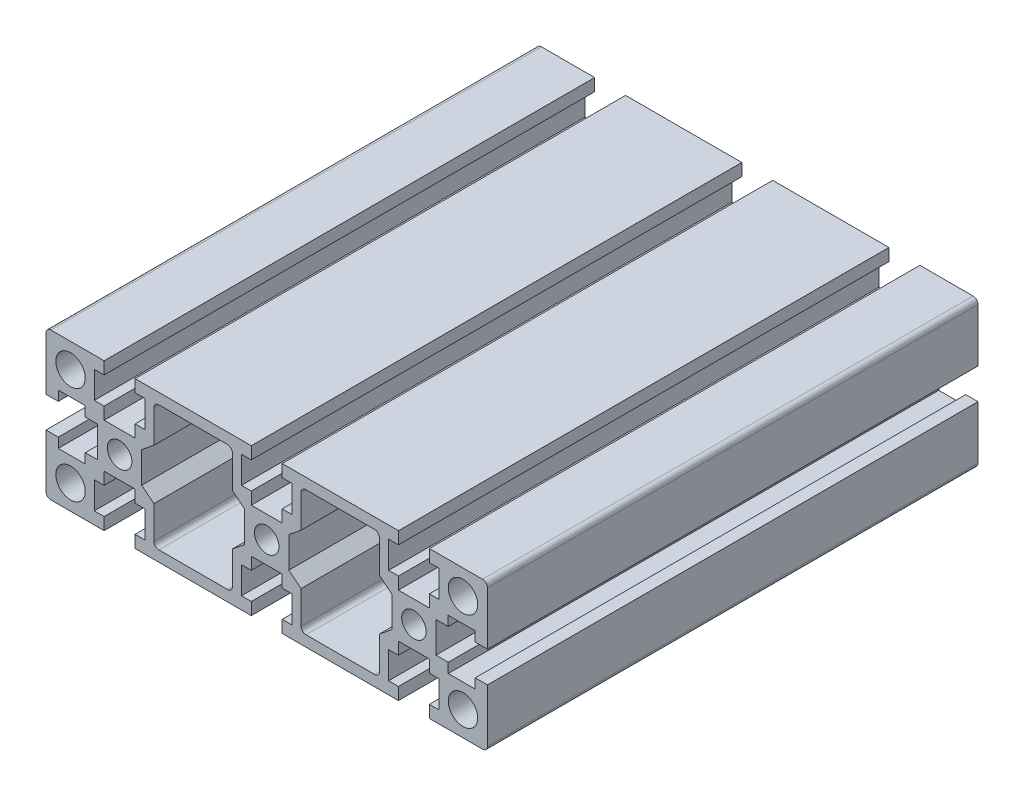
from build123d import *

# Parameters (mm, degrees)
EXTRUDE_1_DEPTH = 100


with BuildPart() as part:
    # 草图1 → 凸台-拉伸1 (new body)
    with BuildSketch(Plane.XY):
        with BuildLine():
            Line((-25.818782805, -14.848597483), (-14.968782805, -14.848597483))
            Line((-14.968782805, -14.848597483), (-2.118782805, -14.848597483))
            Line((-2.118782805, -14.848597483), (-2.118782805, -12.348597483))
            Line((-2.118782805, -12.348597483), (-4.118782805, -12.348597483))
            Line((-4.118782805, -12.348597483), (-4.118782805, -6.848597483))
            Line((-4.118782805, -6.848597483), (-2.118782805, -6.848597483))
            Line((-2.118782805, -6.848597483), (-2.118782805, -4.348597483))
            Line((-2.118782805, -4.348597483), (1.031217195, -4.348597483))
            Line((1.031217195, -4.348597483), (4.181217195, -4.348597483))
            Line((4.181217195, -4.348597483), (4.181217195, -6.848597483))
            Line((4.181217195, -6.848597483), (6.181217195, -6.848597483))
            Line((6.181217195, -6.848597483), (6.181217195, -12.348597483))
            Line((6.181217195, -12.348597483), (4.181217195, -12.348597483))
            Line((4.181217195, -12.348597483), (4.181217195, -14.848597483))
            Line((4.181217195, -14.848597483), (17.031217195, -14.848597483))
            Line((17.031217195, -14.848597483), (27.881217195, -14.848597483))
            Line((27.881217195, -14.848597483), (27.881217195, -12.348597483))
            Line((27.881217195, -12.348597483), (25.881217195, -12.348597483))
            Line((25.881217195, -12.348597483), (25.881217195, -6.848597483))
            Line((25.881217195, -6.848597483), (27.881217195, -6.848597483))
            Line((27.881217195, -6.848597483), (27.881217195, -4.348597483))
            Line((27.881217195, -4.348597483), (31.031217195, -4.348597483))
            Line((31.031217195, -4.348597483), (34.181217195, -4.348597483))
            Line((34.181217195, -4.348597483), (34.181217195, -6.848597483))
            Line((34.181217195, -6.848597483), (36.181217195, -6.848597483))
            Line((36.181217195, -6.848597483), (36.181217195, -12.348597483))
            Line((36.181217195, -12.348597483), (34.181217195, -12.348597483))
            Line((34.181217195, -12.348597483), (34.181217195, -14.848597483))
            Line((34.181217195, -14.848597483), (45.031217195, -14.848597483))
            ThreePointArc((45.031217195, -14.848597483), (45.738323976, -14.555704264), (46.031217195, -13.848597483))
            Line((46.031217195, -13.848597483), (46.031217195, -2.998597483))
            Line((46.031217195, -2.998597483), (43.531217195, -2.998597483))
            Line((43.531217195, -2.998597483), (43.531217195, -4.998597483))
            Line((43.531217195, -4.998597483), (38.031217195, -4.998597483))
            Line((38.031217195, -4.998597483), (38.031217195, -2.998597483))
            Line((38.031217195, -2.998597483), (35.531217195, -2.998597483))
            Line((35.531217195, -2.998597483), (35.531217195, 0.151402517))
            Line((35.531217195, 0.151402517), (35.531217195, 3.301402517))
            Line((35.531217195, 3.301402517), (38.031217195, 3.301402517))
            Line((38.031217195, 3.301402517), (38.031217195, 5.301402517))
            Line((38.031217195, 5.301402517), (43.531217195, 5.301402517))
            Line((43.531217195, 5.301402517), (43.531217195, 3.301402517))
            Line((43.531217195, 3.301402517), (46.031217195, 3.301402517))
            Line((46.031217195, 3.301402517), (46.031217195, 14.151402517))
            ThreePointArc((46.031217195, 14.151402517), (45.738323976, 14.858509298), (45.031217195, 15.151402517))
            Line((45.031217195, 15.151402517), (34.181217195, 15.151402517))
            Line((34.181217195, 15.151402517), (34.181217195, 12.651402517))
            Line((34.181217195, 12.651402517), (36.181217195, 12.651402517))
            Line((36.181217195, 12.651402517), (36.181217195, 7.151402517))
            Line((36.181217195, 7.151402517), (34.181217195, 7.151402517))
            Line((34.181217195, 7.151402517), (34.181217195, 4.651402517))
            Line((34.181217195, 4.651402517), (31.031217195, 4.651402517))
            Line((31.031217195, 4.651402517), (27.881217195, 4.651402517))
            Line((27.881217195, 4.651402517), (27.881217195, 7.151402517))
            Line((27.881217195, 7.151402517), (25.881217195, 7.151402517))
            Line((25.881217195, 7.151402517), (25.881217195, 12.651402517))
            Line((25.881217195, 12.651402517), (27.881217195, 12.651402517))
            Line((27.881217195, 12.651402517), (27.881217195, 15.151402517))
            Line((27.881217195, 15.151402517), (4.181217195, 15.151402517))
            Line((4.181217195, 15.151402517), (4.181217195, 12.651402517))
            Line((4.181217195, 12.651402517), (6.181217195, 12.651402517))
            Line((6.181217195, 12.651402517), (6.181217195, 7.151402517))
            Line((6.181217195, 7.151402517), (4.181217195, 7.151402517))
            Line((4.181217195, 7.151402517), (4.181217195, 4.651402517))
            Line((4.181217195, 4.651402517), (1.031217195, 4.651402517))
            Line((1.031217195, 4.651402517), (-2.118782805, 4.651402517))
            Line((-2.118782805, 4.651402517), (-2.118782805, 7.151402517))
            Line((-2.118782805, 7.151402517), (-4.118782805, 7.151402517))
            Line((-4.118782805, 7.151402517), (-4.118782805, 12.651402517))
            Line((-4.118782805, 12.651402517), (-2.118782805, 12.651402517))
            Line((-2.118782805, 12.651402517), (-2.118782805, 15.151402517))
            Line((-2.118782805, 15.151402517), (-25.818782805, 15.151402517))
            Line((-25.818782805, 15.151402517), (-25.818782805, 12.651402517))
            Line((-25.818782805, 12.651402517), (-23.818782805, 12.651402517))
            Line((-23.818782805, 12.651402517), (-23.818782805, 7.151402517))
            Line((-23.818782805, 7.151402517), (-25.818782805, 7.151402517))
            Line((-25.818782805, 7.151402517), (-25.818782805, 4.651402517))
            Line((-25.818782805, 4.651402517), (-28.968782805, 4.651402517))
            Line((-28.968782805, 4.651402517), (-32.118782805, 4.651402517))
            Line((-32.118782805, 4.651402517), (-32.118782805, 7.151402517))
            Line((-32.118782805, 7.151402517), (-34.118782805, 7.151402517))
            Line((-34.118782805, 7.151402517), (-34.118782805, 12.651402517))
            Line((-34.118782805, 12.651402517), (-32.118782805, 12.651402517))
            Line((-32.118782805, 12.651402517), (-32.118782805, 15.151402517))
            Line((-32.118782805, 15.151402517), (-42.968782805, 15.151402517))
            ThreePointArc((-42.968782805, 15.151402517), (-43.675889586, 14.858509298), (-43.968782805, 14.151402517))
            Line((-43.968782805, 14.151402517), (-43.968782805, 3.301402517))
            Line((-43.968782805, 3.301402517), (-41.468782805, 3.301402517))
            Line((-41.468782805, 3.301402517), (-41.468782805, 5.301402517))
            Line((-41.468782805, 5.301402517), (-35.968782805, 5.301402517))
            Line((-35.968782805, 5.301402517), (-35.968782805, 3.301402517))
            Line((-35.968782805, 3.301402517), (-33.468782805, 3.301402517))
            Line((-33.468782805, 3.301402517), (-33.468782805, 0.151402517))
            Line((-33.468782805, 0.151402517), (-33.468782805, -2.998597483))
            Line((-33.468782805, -2.998597483), (-35.968782805, -2.998597483))
            Line((-35.968782805, -2.998597483), (-35.968782805, -4.998597483))
            Line((-35.968782805, -4.998597483), (-41.468782805, -4.998597483))
            Line((-41.468782805, -4.998597483), (-41.468782805, -2.998597483))
            Line((-41.468782805, -2.998597483), (-43.968782805, -2.998597483))
            Line((-43.968782805, -2.998597483), (-43.968782805, -13.848597483))
            ThreePointArc((-43.968782805, -13.848597483), (-43.675889586, -14.555704264), (-42.968782805, -14.848597483))
            Line((-42.968782805, -14.848597483), (-32.118782805, -14.848597483))
            Line((-32.118782805, -14.848597483), (-32.118782805, -12.348597483))
            Line((-32.118782805, -12.348597483), (-34.118782805, -12.348597483))
            Line((-34.118782805, -12.348597483), (-34.118782805, -6.848597483))
            Line((-34.118782805, -6.848597483), (-32.118782805, -6.848597483))
            Line((-32.118782805, -6.848597483), (-32.118782805, -4.348597483))
            Line((-32.118782805, -4.348597483), (-28.968782805, -4.348597483))
            Line((-28.968782805, -4.348597483), (-25.818782805, -4.348597483))
            Line((-25.818782805, -4.348597483), (-25.818782805, -6.848597483))
            Line((-25.818782805, -6.848597483), (-23.818782805, -6.848597483))
            Line((-23.818782805, -6.848597483), (-23.818782805, -12.348597483))
            Line((-23.818782805, -12.348597483), (-25.818782805, -12.348597483))
            Line((-25.818782805, -12.348597483), (-25.818782805, -14.848597483))
        make_face()
        with BuildLine():
            Line((-24.468782805, 0.151402517), (-24.468782805, 3.301402517))
            Line((-24.468782805, 3.301402517), (-21.968782805, 5.301402517))
            Line((-21.968782805, 5.301402517), (-21.968782805, 11.951402523))
            ThreePointArc((-21.968782805, 11.951402523), (-21.675889587, 12.658509303), (-20.968782806, 12.951402523))
            Line((-20.968782806, 12.951402523), (-13.968782805, 12.951402523))
            Line((-13.968782805, 12.951402523), (-6.968782804, 12.951402523))
            ThreePointArc((-6.968782804, 12.951402523), (-6.261676023, 12.658509303), (-5.968782805, 11.951402523))
            Line((-5.968782805, 11.951402523), (-5.968782805, 5.301402517))
            Line((-5.968782805, 5.301402517), (-3.468782805, 3.301402517))
            Line((-3.468782805, 3.301402517), (-3.468782805, 0.151402517))
            Line((-3.468782805, 0.151402517), (-3.468782805, -2.998597483))
            Line((-3.468782805, -2.998597483), (-5.968782805, -4.998597483))
            Line((-5.968782805, -4.998597483), (-5.968782805, -11.648597489))
            ThreePointArc((-5.968782805, -11.648597489), (-6.261676023, -12.355704269), (-6.968782804, -12.648597489))
            Line((-6.968782804, -12.648597489), (-13.968782805, -12.648597489))
            Line((-13.968782805, -12.648597489), (-20.968782806, -12.648597489))
            ThreePointArc((-20.968782806, -12.648597489), (-21.675889587, -12.355704269), (-21.968782805, -11.648597489))
            Line((-21.968782805, -11.648597489), (-21.968782805, -4.998597483))
            Line((-21.968782805, -4.998597483), (-24.468782805, -2.998597483))
            Line((-24.468782805, -2.998597483), (-24.468782805, 0.151402517))
        make_face(mode=Mode.SUBTRACT)
        with BuildLine():
            Line((5.531217195, -2.998597468), (5.531217195, 0.151402532))
            Line((5.531217195, 0.151402532), (5.531217195, 3.301402532))
            Line((5.531217195, 3.301402532), (8.031217195, 5.301402517))
            Line((8.031217195, 5.301402517), (8.031217195, 11.951402523))
            ThreePointArc((8.031217195, 11.951402523), (8.324110413, 12.658509303), (9.031217194, 12.951402523))
            Line((9.031217194, 12.951402523), (16.031217195, 12.951402523))
            Line((16.031217195, 12.951402523), (23.031217196, 12.951402523))
            ThreePointArc((23.031217196, 12.951402523), (23.738323977, 12.658509303), (24.031217195, 11.951402523))
            Line((24.031217195, 11.951402523), (24.031217195, 5.301402517))
            Line((24.031217195, 5.301402517), (26.531217195, 3.301402517))
            Line((26.531217195, 3.301402517), (26.531217195, 0.151402517))
            Line((26.531217195, 0.151402517), (26.531217195, -2.998597483))
            Line((26.531217195, -2.998597483), (24.031217195, -4.998597483))
            Line((24.031217195, -4.998597483), (24.031217195, -11.648597489))
            ThreePointArc((24.031217195, -11.648597489), (23.738323977, -12.355704269), (23.031217196, -12.648597489))
            Line((23.031217196, -12.648597489), (16.031217195, -12.648597489))
            Line((16.031217195, -12.648597489), (9.031217194, -12.648597489))
            ThreePointArc((9.031217194, -12.648597489), (8.324110413, -12.355704269), (8.031217195, -11.648597489))
            Line((8.031217195, -11.648597489), (8.031217195, -4.998597483))
            Line((8.031217195, -4.998597483), (5.531217195, -2.998597468))
        make_face(mode=Mode.SUBTRACT)
        with BuildLine():
            ThreePointArc((-35.968782805, 10.151402517), (-38.968782805, 13.151402517), (-41.968782805, 10.151402517))
            ThreePointArc((-41.968782805, 10.151402517), (-38.968782805, 7.151402517), (-35.968782805, 10.151402517))
        make_face(mode=Mode.SUBTRACT)
        with BuildLine():
            ThreePointArc((-41.968782805, -9.848597483), (-38.968782805, -12.848597483), (-35.968782805, -9.848597483))
            ThreePointArc((-35.968782805, -9.848597483), (-38.968782805, -6.848597483), (-41.968782805, -9.848597483))
        make_face(mode=Mode.SUBTRACT)
        with BuildLine():
            ThreePointArc((-26.468782805, 0.151402517), (-28.968782805, 2.651402517), (-31.468782805, 0.151402517))
            ThreePointArc((-31.468782805, 0.151402517), (-28.968782805, -2.348597483), (-26.468782805, 0.151402517))
        make_face(mode=Mode.SUBTRACT)
        with BuildLine():
            ThreePointArc((3.531217195, 0.151402532), (1.031217195, 2.651402532), (-1.468782805, 0.151402532))
            ThreePointArc((-1.468782805, 0.151402532), (1.031217195, -2.348597468), (3.531217195, 0.151402532))
        make_face(mode=Mode.SUBTRACT)
        with BuildLine():
            ThreePointArc((44.031217195, 10.151402517), (41.031217195, 13.151402517), (38.031217195, 10.151402517))
            ThreePointArc((38.031217195, 10.151402517), (41.031217195, 7.151402517), (44.031217195, 10.151402517))
        make_face(mode=Mode.SUBTRACT)
        with BuildLine():
            ThreePointArc((38.031217195, -9.848597483), (41.031217195, -12.848597483), (44.031217195, -9.848597483))
            ThreePointArc((44.031217195, -9.848597483), (41.031217195, -6.848597483), (38.031217195, -9.848597483))
        make_face(mode=Mode.SUBTRACT)
        with BuildLine():
            ThreePointArc((33.531217195, 0.151402517), (31.031217195, 2.651402517), (28.531217195, 0.151402517))
            ThreePointArc((28.531217195, 0.151402517), (31.031217195, -2.348597483), (33.531217195, 0.151402517))
        make_face(mode=Mode.SUBTRACT)
    extrude(amount=EXTRUDE_1_DEPTH)


solid = part.part
